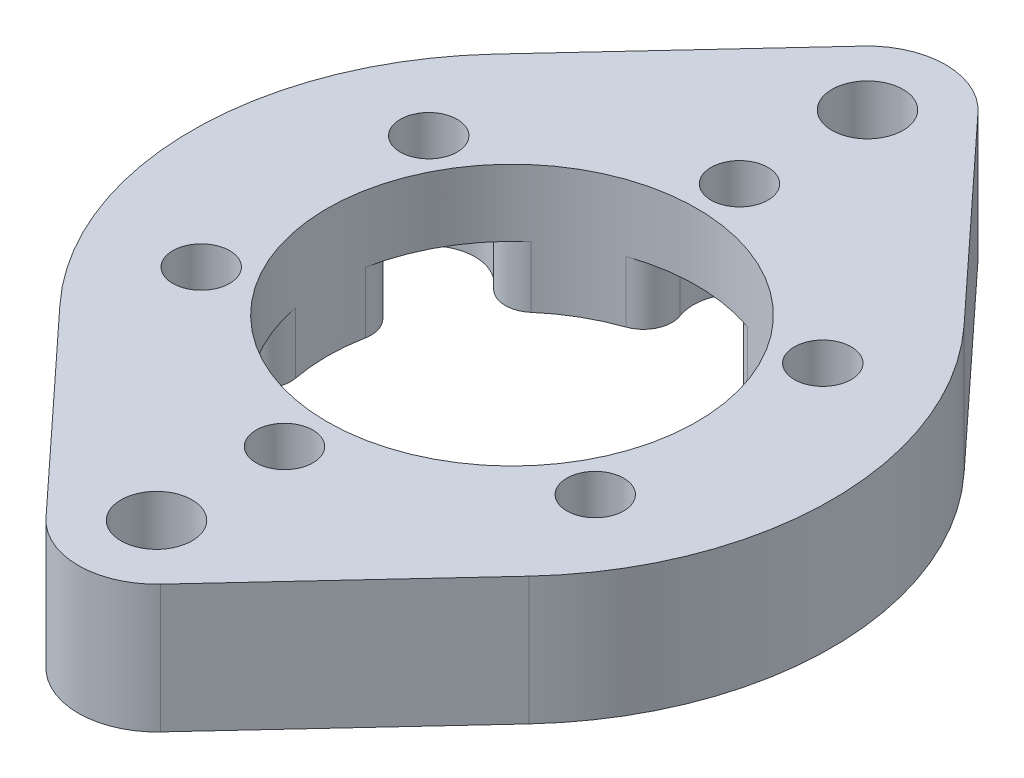
from build123d import *

# Parameters (mm, degrees)
SKETCH1_R           = 13
SKETCH1_R_2         = 2
SKETCH1_R_3         = 2.5
BOSS_EXTRUDE1_DEPTH = 9
CUT_EXTRUDE2_START  = -4.3
SKETCH3_R           = 3.25
CUT_EXTRUDE2_DEPTH  = 4.3
FILLET1_R           = 2


with BuildPart() as part:
    # Sketch1 → Boss-Extrude1 (new body)
    with BuildSketch(Plane(origin=(0, 0, 0), x_dir=(1, 0, 0), z_dir=(0, 1, 0))):
        with BuildLine():
            Line((-4.032667043, 28.739999939), (-16.497272732, 15.299999752))
            ThreePointArc((-16.497272732, 15.299999752), (-22.5, 0), (-16.497272732, -15.299999752))
            Line((-16.497272732, -15.299999752), (-4.032667043, -28.739999939))
            ThreePointArc((-4.032667043, -28.739999939), (-3.38e-07, -30.499999725), (4.03266618, -28.740000061))
            Line((4.03266618, -28.740000061), (16.497272272, -15.300000248))
            ThreePointArc((16.497272272, -15.300000248), (22.5, 0), (16.497272272, 15.300000248))
            Line((16.497272272, 15.300000248), (4.03266618, 28.740000061))
            ThreePointArc((4.03266618, 28.740000061), (-4.58e-07, 30.5), (-4.032667043, 28.739999939))
        make_face()
        with Locations(Location((0, 0, 0), (0, 0, 270))):
            Circle(SKETCH1_R, mode=Mode.SUBTRACT)
        with Locations(Location((0, 16, 0), (0, 0, 270))):
            Circle(SKETCH1_R_2, mode=Mode.SUBTRACT)
        with Locations(Location((13.856406461, 8, 0), (0, 0, 270))):
            Circle(SKETCH1_R_2, mode=Mode.SUBTRACT)
        with Locations(Location((13.856406461, -8, 0), (0, 0, 270))):
            Circle(SKETCH1_R_2, mode=Mode.SUBTRACT)
        with Locations(Location((0, -16, 0), (0, 0, 270))):
            Circle(SKETCH1_R_2, mode=Mode.SUBTRACT)
        with Locations(Location((-13.856406461, -8, 0), (0, 0, 270))):
            Circle(SKETCH1_R_2, mode=Mode.SUBTRACT)
        with Locations(Location((-13.856406461, 8, 0), (0, 0, 270))):
            Circle(SKETCH1_R_2, mode=Mode.SUBTRACT)
        with Locations(Location((-3.76e-07, 25, 0), (0, 0, 270))):
            Circle(SKETCH1_R_3, mode=Mode.SUBTRACT)
        with Locations(Location((0, -25, 0), (0, 0, 270))):
            Circle(SKETCH1_R_3, mode=Mode.SUBTRACT)
    extrude(amount=BOSS_EXTRUDE1_DEPTH)

    # Sketch3 → Cut-Extrude2 (cut)
    with BuildSketch(Plane.XZ.offset(CUT_EXTRUDE2_START)):
        with Locations((0, -16)):
            Circle(SKETCH3_R)
        with Locations((-13.856406461, -8)):
            Circle(SKETCH3_R)
        with Locations((-13.856406461, 8)):
            Circle(SKETCH3_R)
        with Locations((0, 16)):
            Circle(SKETCH3_R)
        with Locations((13.856406461, 8)):
            Circle(SKETCH3_R)
        with Locations((13.856406461, -8)):
            Circle(SKETCH3_R)
    extrude(amount=CUT_EXTRUDE2_DEPTH, mode=Mode.SUBTRACT)

    # Fillet1
    fillet1_edges = [part.edges().sort_by_distance(p)[0] for p in [
        (-11.778881987, 2.15, -5.500721691),
        (-10.653205718, 2.15, -7.450450184),
        (-10.653205718, 2.15, 7.450450184),
        (-11.778881987, 2.15, 5.500721691),
        (1.12567627, 2.15, 12.951171875),
        (-1.12567627, 2.15, 12.951171875),
        (11.778881987, 2.15, 5.500721691),
        (10.653205718, 2.15, 7.450450184),
        (10.653205718, 2.15, -7.450450184),
        (11.778881987, 2.15, -5.500721691),
        (-1.12567627, 2.15, -12.951171875),
        (1.12567627, 2.15, -12.951171875),
    ]]
    fillet(fillet1_edges, radius=FILLET1_R)


solid = part.part
